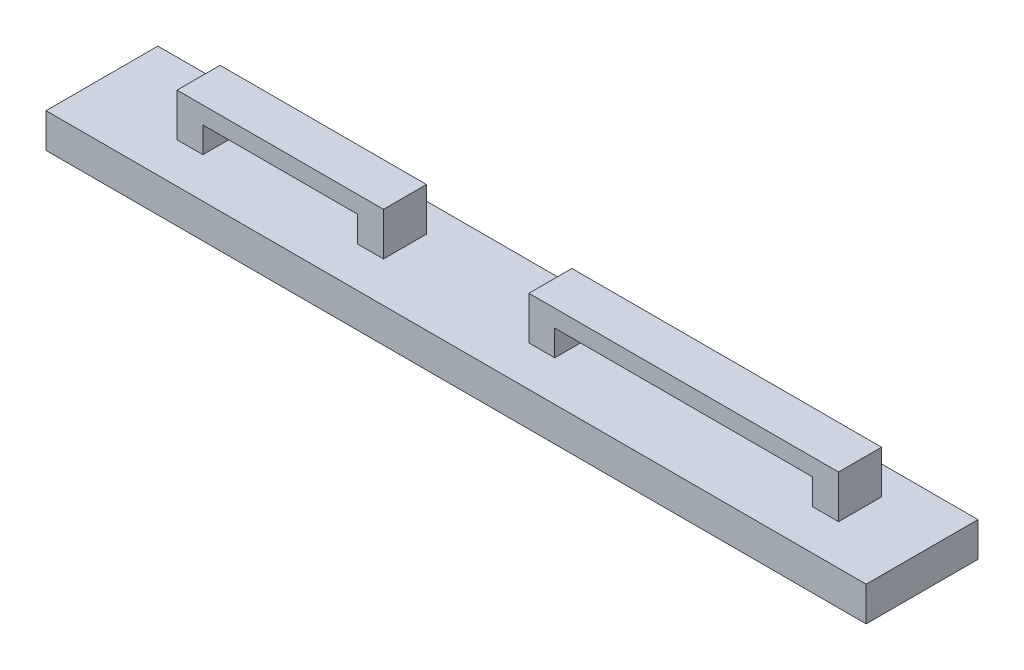
from build123d import *

# Parameters (mm, degrees)
SKETCH1_W           = 47.678483764
SKETCH1_H           = 13.004323218
BOSS_EXTRUDE1_DEPTH = 2
SKETCH2_W           = 1.5
SKETCH2_H           = 2.5
BOSS_EXTRUDE2_DEPTH = 1.5
SKETCH3_W           = 12
SKETCH3_H           = 2.5
SKETCH3_W_2         = 18
BOSS_EXTRUDE3_DEPTH = 1
SKETCH4_W           = 47.678483764
SKETCH4_H           = 6.502161609
CUT_EXTRUDE1_DEPTH  = 25.83621467


with BuildPart() as part:
    # Sketch1 → Boss-Extrude1 (new body)
    with BuildSketch(Plane(origin=(0, 0, 0), x_dir=(1, 0, 0), z_dir=(0, 1, 0))):
        Rectangle(SKETCH1_W, SKETCH1_H)
    extrude(amount=BOSS_EXTRUDE1_DEPTH)

    # Sketch2 → Boss-Extrude2 (add)
    with BuildSketch(Plane(origin=(0, 2, 0), x_dir=(1, 0, 0), z_dir=(0, 1, 0))):
        with Locations((-17.814028346, -2.908609225)):
            Rectangle(SKETCH2_W, SKETCH2_H)
        with Locations((-7.314028346, -2.908609225)):
            Rectangle(SKETCH2_W, SKETCH2_H)
        with Locations((2.641012715, -2.908609225)):
            Rectangle(SKETCH2_W, SKETCH2_H)
        with Locations((19.141012715, -2.908609225)):
            Rectangle(SKETCH2_W, SKETCH2_H)
    extrude(amount=BOSS_EXTRUDE2_DEPTH)

    # Sketch3 → Boss-Extrude3 (add)
    with BuildSketch(Plane(origin=(0, 3.5, 0), x_dir=(1, 0, 0), z_dir=(0, 1, 0))):
        with Locations((-12.564028346, -2.908609225)):
            Rectangle(SKETCH3_W, SKETCH3_H)
        with Locations((10.891012715, -2.908609225)):
            Rectangle(SKETCH3_W_2, SKETCH3_H)
    extrude(amount=BOSS_EXTRUDE3_DEPTH)

    # Sketch4 → Cut-Extrude1 (cut, through all)
    with BuildSketch(Plane(origin=(0, 2, 0), x_dir=(1, 0, 0), z_dir=(0, 1, 0))):
        with Locations((0, 3.251080805)):
            Rectangle(SKETCH4_W, SKETCH4_H)
    extrude(amount=-CUT_EXTRUDE1_DEPTH, mode=Mode.SUBTRACT)


solid = part.part
